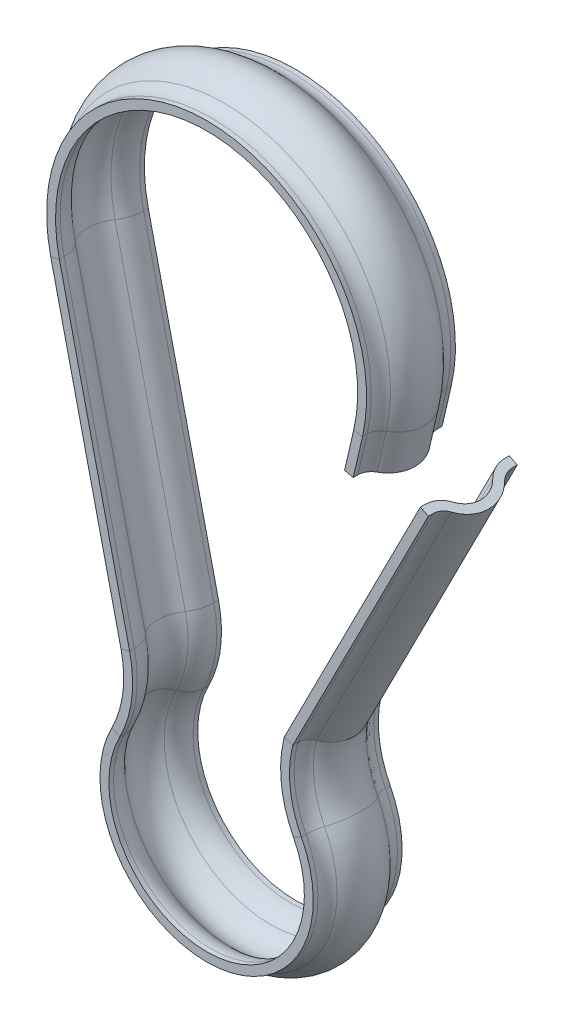
from build123d import *


with BuildPart() as part:
    # Sweep1: sweep along a path in Sketch1
    with BuildLine(Plane.XY) as sweep1_path:
        Line((9.224134218, -4.5), (9.743700648, -2.249510543))
        ThreePointArc((9.743700648, -2.249510543), (0, 10), (-9.743700648, -2.249510543))
        Line((-9.743700648, -2.249510543), (-5.791026476, -19.370423356))
        ThreePointArc((-5.791026476, -19.370423356), (-5.70178828, -21.117754485), (-6.220011467, -22.788854199))
        ThreePointArc((-6.220011467, -22.788854199), (0, -33), (6.220011467, -22.788854199))
        ThreePointArc((6.220011467, -22.788854199), (5.70178828, -21.117754485), (5.791026476, -19.370423356))
        Line((5.791026476, -19.370423356), (13.367885621, -4.5))
    # Sketch2 → Sweep1 (sweep)
    with BuildSketch(Plane(origin=(0, 0, 0), x_dir=(0, 0, -1), z_dir=(1, 0, 0))):
        with BuildLine():
            Line((-2.5, 9), (-2.236067977, 9))
            ThreePointArc((-2.236067977, 9), (-1.827819687, 9.087129071), (-1.490711985, 9.333333333))
            ThreePointArc((-1.490711985, 9.333333333), (0, 10), (1.490711985, 9.333333333))
            ThreePointArc((1.490711985, 9.333333333), (1.827819687, 9.087129071), (2.236067977, 9))
            Line((2.236067977, 9), (2.5, 9))
            Line((2.5, 9), (2.5, 8.5))
            Line((2.5, 8.5), (2.236067977, 8.5))
            ThreePointArc((2.236067977, 8.5), (1.623695542, 8.630693606), (1.118033989, 9))
            ThreePointArc((1.118033989, 9), (0, 9.5), (-1.118033989, 9))
            ThreePointArc((-1.118033989, 9), (-1.623695542, 8.630693606), (-2.236067977, 8.5))
            Line((-2.236067977, 8.5), (-2.5, 8.5))
            Line((-2.5, 8.5), (-2.5, 9))
        make_face()
    sweep(path=sweep1_path.line, transition=Transition.RIGHT)


solid = part.part
